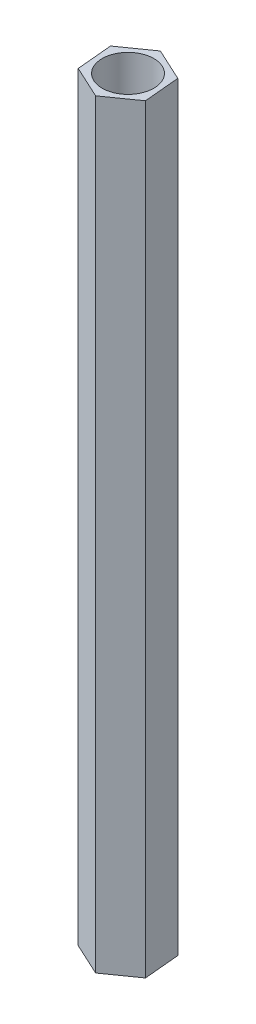
from build123d import *

# Parameters (mm, degrees)
EXTRUDE_1_DEPTH     = 36.82
SKETCH_2_R          = 1.25
CUT_EXTRUDE_1_DEPTH = 37.893902572


with BuildPart() as part:
    # 草图1 → 凸台-拉伸1 (new body)
    with BuildSketch(Plane(origin=(0, 0, 0), x_dir=(1, 0, 0), z_dir=(0, 1, 0))):
        Polygon((1.572362552, -0.726413109), (1.415273482, 0.99849936), (-0.15708907, 1.724912469), (-1.572362552, 0.726413109), (-1.415273482, -0.99849936), (0.15708907, -1.724912469), align=None)
    extrude(amount=EXTRUDE_1_DEPTH)

    # 草图2 → 切除-拉伸1 (cut, through all)
    with BuildSketch(Plane(origin=(0, 36.82, 0), x_dir=(1, 0, 0), z_dir=(0, 1, 0))):
        with Locations(Location((0, 0, 0), (0, 0, 270))):
            Circle(SKETCH_2_R)
    extrude(amount=-CUT_EXTRUDE_1_DEPTH, mode=Mode.SUBTRACT)


solid = part.part
